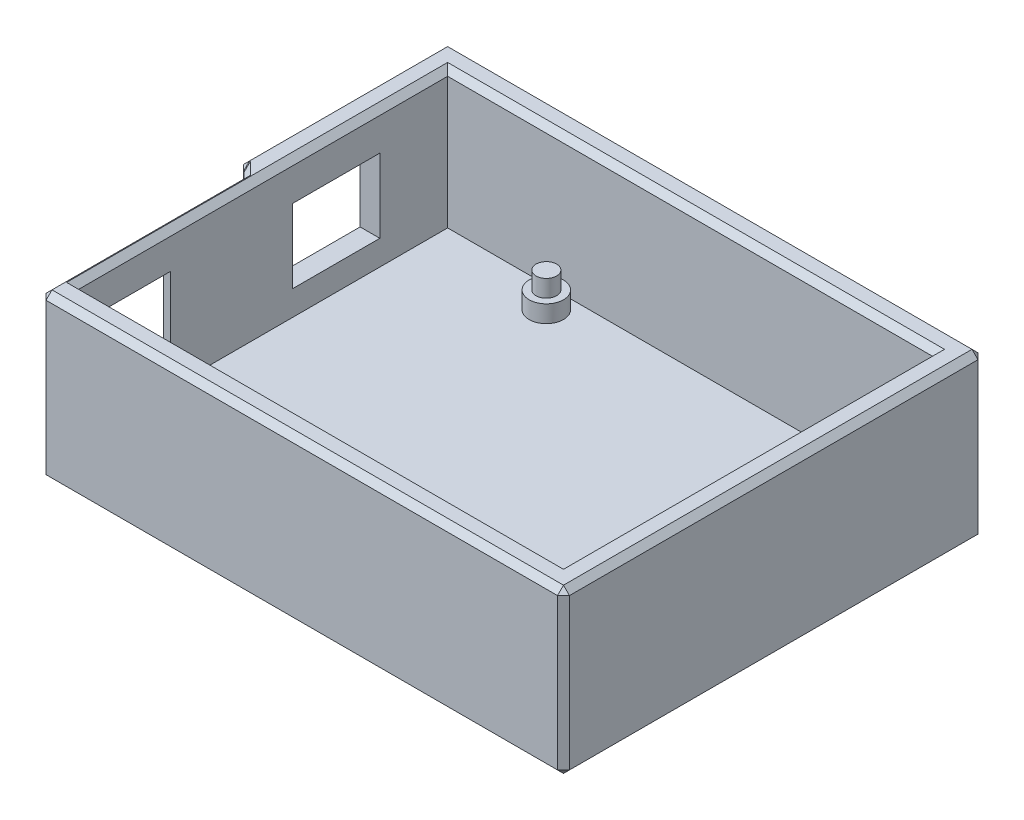
from build123d import *

# Parameters (mm, degrees)
SKETCH1_W           = 79.375
SKETCH1_H           = 62.23
BOSS_EXTRUDE1_DEPTH = 24.13
SHELL1_T            = -3.81
RISER_BASE_SKETCH_R = 2.54
BOSS_EXTRUDE3_DEPTH = 2.54
SKETCH9_R           = 1.524
BOSS_EXTRUDE4_DEPTH = 2.54
SKETCH10_W          = 12.954
SKETCH10_H          = 10.922
CUT_EXTRUDE1_DEPTH  = 3.81
SKETCH12_W          = 9.254
SKETCH12_H          = 11.254
CUT_EXTRUDE2_DEPTH  = 3.81
SKETCH13_W          = 31.115
SKETCH13_H          = 24.13
CUT_EXTRUDE3_DEPTH  = 1.905
CHAMFER1_SIZE       = 0.889


with BuildPart() as part:
    # Sketch1 → Boss-Extrude1 (new body)
    with BuildSketch(Plane(origin=(0, 0, 0), x_dir=(1, 0, 0), z_dir=(0, 1, 0))):
        Rectangle(SKETCH1_W, SKETCH1_H)
    extrude(amount=-BOSS_EXTRUDE1_DEPTH)

    # Shell1
    shell1_openings = [part.faces().sort_by_distance(p)[0] for p in [
        (0, 0, 0),
    ]]
    offset(amount=SHELL1_T, openings=shell1_openings, kind=Kind.INTERSECTION)

    # riser base sketch → Boss-Extrude3 (add)
    with BuildSketch(Plane(origin=(0, -20.32, 0), x_dir=(1, 0, 0), z_dir=(0, 1, 0))):
        with Locations(Location((32.7025, 8.89, 0), (0, 0, 90))):
            Circle(RISER_BASE_SKETCH_R)
        with Locations(Location((-18.0975, 24.13, 0), (0, 0, 90))):
            Circle(RISER_BASE_SKETCH_R)
        with Locations(Location((-19.3675, -24.13, 0), (0, 0, 90))):
            Circle(RISER_BASE_SKETCH_R)
        with Locations(Location((32.7025, -19.05, 0), (0, 0, 90))):
            Circle(RISER_BASE_SKETCH_R)
    extrude(amount=BOSS_EXTRUDE3_DEPTH)

    # Sketch9 → Boss-Extrude4 (add)
    with BuildSketch(Plane(origin=(0, -17.78, 0), x_dir=(-1, 0, 0), z_dir=(0, 1, 0))):
        with Locations(Location((19.3675, 24.13, 0), (0, 0, 270))):
            Circle(SKETCH9_R)
        with Locations(Location((-32.7025, 19.05, 0), (0, 0, 270))):
            Circle(SKETCH9_R)
        with Locations(Location((-32.7025, -8.89, 0), (0, 0, 270))):
            Circle(SKETCH9_R)
        with Locations(Location((18.0975, -24.13, 0), (0, 0, 270))):
            Circle(SKETCH9_R)
    extrude(amount=BOSS_EXTRUDE4_DEPTH)

    # Sketch10 → Cut-Extrude1 (cut)
    with BuildSketch(Plane.ZY.offset(39.6875)):
        with Locations((-10.795, -11.176)):
            Rectangle(SKETCH10_W, SKETCH10_H)
    extrude(amount=-CUT_EXTRUDE1_DEPTH, mode=Mode.SUBTRACT)

    # Sketch12 → Cut-Extrude2 (cut)
    with BuildSketch(Plane.ZY.offset(39.6875)):
        with Locations((18.36, -11.01)):
            Rectangle(SKETCH12_W, SKETCH12_H)
    extrude(amount=-CUT_EXTRUDE2_DEPTH, mode=Mode.SUBTRACT)

    # Sketch13 → Cut-Extrude3 (cut)
    with BuildSketch(Plane.ZY.offset(39.6875)):
        with Locations((15.5575, -12.065)):
            Rectangle(SKETCH13_W, SKETCH13_H)
    extrude(amount=-CUT_EXTRUDE3_DEPTH, mode=Mode.SUBTRACT)

    # Chamfer1
    chamfer1_edges = [part.edges().sort_by_distance(p)[0] for p in [
        (-39.6875, -24.13, -15.5575),
        (35.8775, 0, 0),
        (0, 0, -27.305),
        (-35.8775, 0, 0),
        (0, 0, 27.305),
        (39.6875, -24.13, 0),
        (-39.6875, 0, -15.5575),
        (0, 0, -31.115),
        (39.6875, 0, 0),
        (-39.6875, -11.176, -17.272),
        (-39.6875, -16.637, -10.795),
        (-39.6875, -11.176, -4.318),
        (-39.6875, -5.715, -10.795),
        (0, -24.13, -31.115),
        (39.6875, -12.065, 31.115),
        (-39.6875, -12.065, -31.115),
        (39.6875, -12.065, -31.115),
        (-37.7825, -16.637, 18.36),
        (0.9525, -24.13, 31.115),
        (0.9525, 0, 31.115),
        (-39.6875, -12.065, 0),
        (-37.7825, -12.065, 31.115),
        (-37.7825, -24.13, 15.5575),
        (-37.7825, -12.065, 0),
        (-38.735, -24.13, 0),
        (-37.7825, 0, 15.5575),
        (-38.735, 0, 0),
        (-37.7825, -11.01, 13.733),
        (-37.7825, -5.383, 18.36),
        (-37.7825, -11.01, 22.987),
    ]]
    chamfer(chamfer1_edges, length=CHAMFER1_SIZE)


solid = part.part
